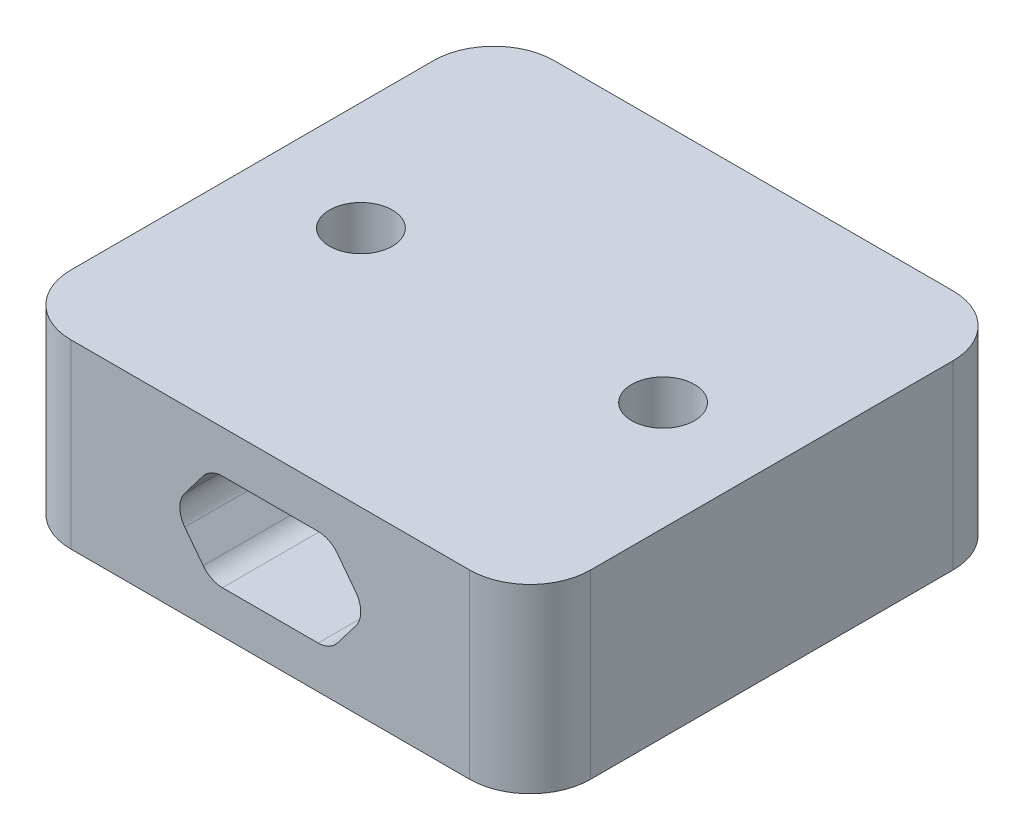
from build123d import *

# Parameters (mm, degrees)
SKETCH1_W           = 43
SKETCH1_H           = 40
BOSS_EXTRUDE1_DEPTH = 15
CUT_EXTRUDE1_DEPTH  = 25
SKETCH3_R           = 3
CUT_EXTRUDE2_DEPTH  = 61.613529843
SKETCH4_R           = 2.6
CUT_EXTRUDE3_DEPTH  = 61.613529843
FILLET1_R           = 2
FILLET3_R           = 5


with BuildPart() as part:
    # Sketch1 → Boss-Extrude1 (new body)
    with BuildSketch(Plane(origin=(0, 0, 0), x_dir=(1, 0, 0), z_dir=(0, 1, 0))):
        with Locations((21.5, 20)):
            Rectangle(SKETCH1_W, SKETCH1_H)
    extrude(amount=BOSS_EXTRUDE1_DEPTH)

    # Sketch2 → Cut-Extrude1 (cut)
    with BuildSketch(Plane.XY):
        Polygon((13.5, 7.5), (16.55, 11.5), (26.45, 11.5), (29.5, 7.5), (26.45, 3.5), (16.55, 3.5), align=None)
    extrude(amount=-CUT_EXTRUDE1_DEPTH, mode=Mode.SUBTRACT)

    # Sketch3 → Cut-Extrude2 (cut, through all)
    with BuildSketch(Plane.XY):
        with Locations((21.5, 7.5)):
            Circle(SKETCH3_R)
    extrude(amount=-CUT_EXTRUDE2_DEPTH, mode=Mode.SUBTRACT)

    # Sketch4 → Cut-Extrude3 (cut, through all)
    with BuildSketch(Plane(origin=(0, 0, 0), x_dir=(1, 0, 0), z_dir=(0, 1, 0))):
        with Locations(Location((9, 20, 0), (0, 0, 270))):
            Circle(SKETCH4_R)
        with Locations(Location((34, 20, 0), (0, 0, 270))):
            Circle(SKETCH4_R)
    extrude(amount=CUT_EXTRUDE3_DEPTH, mode=Mode.SUBTRACT)

    # Fillet1
    fillet1_edges = [part.edges().sort_by_distance(p)[0] for p in [
        (16.55, 3.5, -12.5),
        (13.5, 7.5, -12.5),
        (16.55, 11.5, -12.5),
        (26.45, 11.5, -12.5),
        (29.5, 7.5, -12.5),
        (26.45, 3.5, -12.5),
    ]]
    fillet(fillet1_edges, radius=FILLET1_R)

    # Fillet3
    fillet3_edges = [part.edges().sort_by_distance(p)[0] for p in [
        (0, 7.5, -40),
        (43, 7.5, -40),
        (43, 7.5, 0),
        (0, 7.5, 0),
    ]]
    fillet(fillet3_edges, radius=FILLET3_R)


solid = part.part
